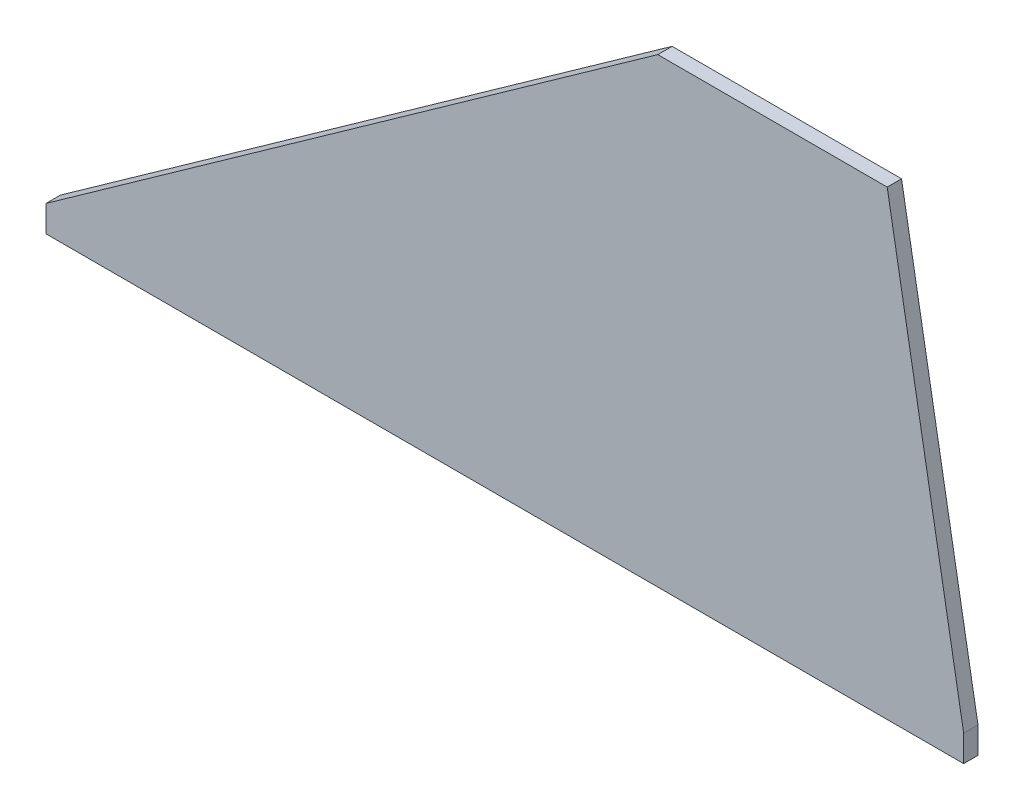
from build123d import *

# Parameters (mm, degrees)
BOSS_EXTRUDE1_DEPTH = 2.38125


with BuildPart() as part:
    # Sketch1 → Boss-Extrude1 (new, symmetric)
    with BuildSketch(Plane.XY):
        Polygon((0, 0), (304.8, 0), (304.8, 8.763), (279.4, 153.162), (203.2, 153.162), (0, 8.763), align=None)
    extrude(amount=BOSS_EXTRUDE1_DEPTH, both=True)


solid = part.part
